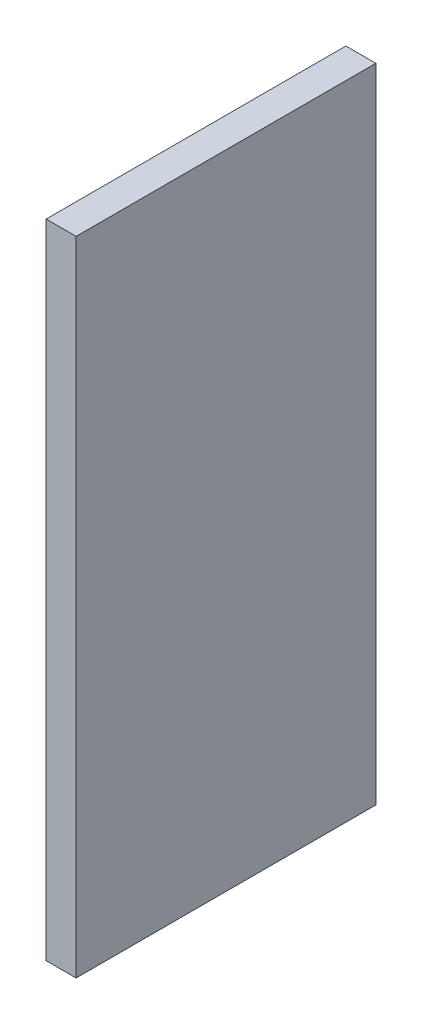
from build123d import *

# Parameters (mm, degrees)
SKETCH1_W           = 7
SKETCH1_H           = 150
BOSS_EXTRUDE1_DEPTH = 70


with BuildPart() as part:
    # Sketch1 → Boss-Extrude1 (new body)
    with BuildSketch(Plane.XY):
        with Locations((3.5, 75)):
            Rectangle(SKETCH1_W, SKETCH1_H)
    extrude(amount=BOSS_EXTRUDE1_DEPTH)


solid = part.part
